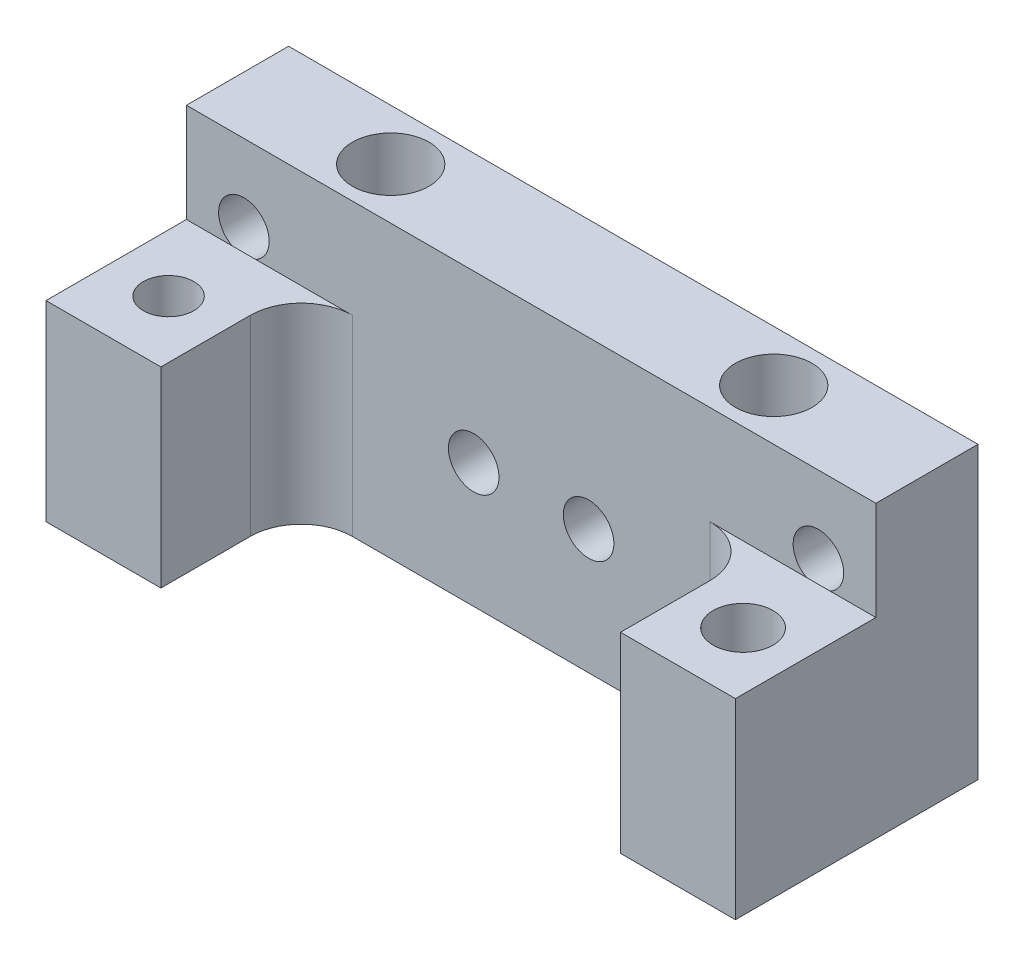
from build123d import *

# Parameters (mm, degrees)
SKETCH1_W                                    = 38
SKETCH1_H                                    = 8
BOSS_EXTRUDE1_DEPTH                          = 22.75
SKETCH9_W                                    = 9
SKETCH9_H                                    = 5
BOSS_EXTRUDE2_DEPTH                          = 19
SKETCH8_R                                    = 3
CUT_EXTRUDE1_DEPTH                           = 18
CSK_FOR_M3_COUNTERSUNK_FLAT_HEAD_SCR_2_COUNT = 2
CSK_FOR_M3_COUNTERSUNK_FLAT_HEAD_SCR_2_PITCH = 30
FILLET1_R                                    = 2
BOSS_EXTRUDE3_DEPTH                          = 22.75
SKETCH16_R                                   = 1.98
CUT_EXTRUDE4_DEPTH                           = 8
SKETCH14_W                                   = 54
SKETCH14_H                                   = 11
CUT_EXTRUDE6_DEPTH                           = 7.75
SKETCH15_R                                   = 1.98
SKETCH15_R_2                                 = 2.35
CUT_EXTRUDE7_DEPTH                           = 4
M3_CLEARANCE_HOLE2_D                         = 3.6
FILLET2_R                                    = 4


with BuildPart() as part:
    # Sketch1 → Boss-Extrude1 (new body)
    with BuildSketch(Plane(origin=(0, 0, 0), x_dir=(1, 0, 0), z_dir=(0, 1, 0))):
        Rectangle(SKETCH1_W, SKETCH1_H)
    extrude(amount=BOSS_EXTRUDE1_DEPTH)

    # Sketch9 → Boss-Extrude2 (add)
    with BuildSketch(Plane.XY.offset(-4)):
        with Locations((-22.5, 12.5)):
            Rectangle(SKETCH9_W, SKETCH9_H)
        with Locations((22.5, 12.5)):
            Rectangle(SKETCH9_W, SKETCH9_H)
    extrude(amount=BOSS_EXTRUDE2_DEPTH)

    # Sketch8 → Cut-Extrude1 (cut)
    with BuildSketch(Plane(origin=(0, 22.75, 0), x_dir=(1, 0, 0), z_dir=(0, 1, 0))):
        with Locations(Location((-15, 0, 0), (0, 0, 270))):
            Circle(SKETCH8_R)
        with Locations(Location((15, 0, 0), (0, 0, 270))):
            Circle(SKETCH8_R)
    extrude(amount=-CUT_EXTRUDE1_DEPTH, mode=Mode.SUBTRACT)

    # Sketch4 → CSK for M3 Countersunk Flat Head Screw1 (revolve, cut)
    with BuildSketch(Plane(origin=(-15, 4.75, 0), x_dir=(0, 0, 1), z_dir=(1, 0, 0))):
        Polygon((0, 0), (0, 4.75), (1.7, 4.75), (1.7, 1.45), (3.15, 0), align=None)
    csk_for_m3_countersunk_flat_head_screw1 = revolve(axis=Axis((-15, 11.1, 0), (0, -1, 0)), mode=Mode.SUBTRACT)

    # CSK for M3 Countersunk Flat Head Scr 2: CSK for M3 Countersunk Flat Head Screw1 ×2
    with Locations(*[(i * CSK_FOR_M3_COUNTERSUNK_FLAT_HEAD_SCR_2_PITCH, 0, 0) for i in range(1, CSK_FOR_M3_COUNTERSUNK_FLAT_HEAD_SCR_2_COUNT)]):
        add(csk_for_m3_countersunk_flat_head_screw1, mode=Mode.SUBTRACT)

    # Fillet1
    fillet1_edges = [part.edges().sort_by_distance(p)[0] for p in [
        (-27, 12.5, 15),
        (-18, 12.5, 15),
        (27, 12.5, 15),
        (18, 12.5, 15),
    ]]
    fillet(fillet1_edges, radius=FILLET1_R)

    # Sketch13 → Boss-Extrude3 (add)
    with BuildSketch(Plane(origin=(0, 0, 0), x_dir=(-1, 0, 0), z_dir=(0, -1, 0))):
        Polygon((-18, -4), (-18, 4), (-27, 4), (-27, -4), (-27, -15), (-18, -15), align=None)
        Polygon((27, 4), (18, 4), (18, -4), (18, -15), (27, -15), (27, -4), align=None)
    extrude(amount=-BOSS_EXTRUDE3_DEPTH)

    # Sketch16 → Cut-Extrude4 (cut)
    with BuildSketch(Plane.XY.offset(-4)):
        with Locations((-22.5, 16.75)):
            Circle(SKETCH16_R)
        with Locations((-4.5, 9.75)):
            Circle(SKETCH16_R)
        with Locations((4.5, 9.75)):
            Circle(SKETCH16_R)
        with Locations((22.5, 16.75)):
            Circle(SKETCH16_R)
    extrude(amount=CUT_EXTRUDE4_DEPTH, mode=Mode.SUBTRACT)

    # Sketch14 → Cut-Extrude6 (cut)
    with BuildSketch(Plane(origin=(0, 22.75, 0), x_dir=(1, 0, 0), z_dir=(0, 1, 0))):
        with Locations((0, -9.5)):
            Rectangle(SKETCH14_W, SKETCH14_H)
    extrude(amount=-CUT_EXTRUDE6_DEPTH, mode=Mode.SUBTRACT)

    # Sketch15 → Cut-Extrude7 (cut)
    with BuildSketch(Plane(origin=(0, 15, 0), x_dir=(1, 0, 0), z_dir=(0, 1, 0))):
        with Locations(Location((-22.5, -9.9, 0), (0, 0, 270))):
            Circle(SKETCH15_R)
        with Locations(Location((22.5, -9.9, 0), (0, 0, 270))):
            Circle(SKETCH15_R_2)
    extrude(amount=-CUT_EXTRUDE7_DEPTH, mode=Mode.SUBTRACT)

    # M3 Clearance Hole2 (through all)
    with Locations(Plane(origin=(0, 11, 0), x_dir=(1, 0, 0), z_dir=(0, 1, 0))):
        with Locations((-22.5, -9.9), (22.5, -9.9)):
            Hole(M3_CLEARANCE_HOLE2_D / 2)

    # Fillet2
    fillet2_edges = [part.edges().sort_by_distance(p)[0] for p in [
        (-18, 7.5, 4),
        (18, 7.5, 4),
    ]]
    fillet(fillet2_edges, radius=FILLET2_R)


solid = part.part
